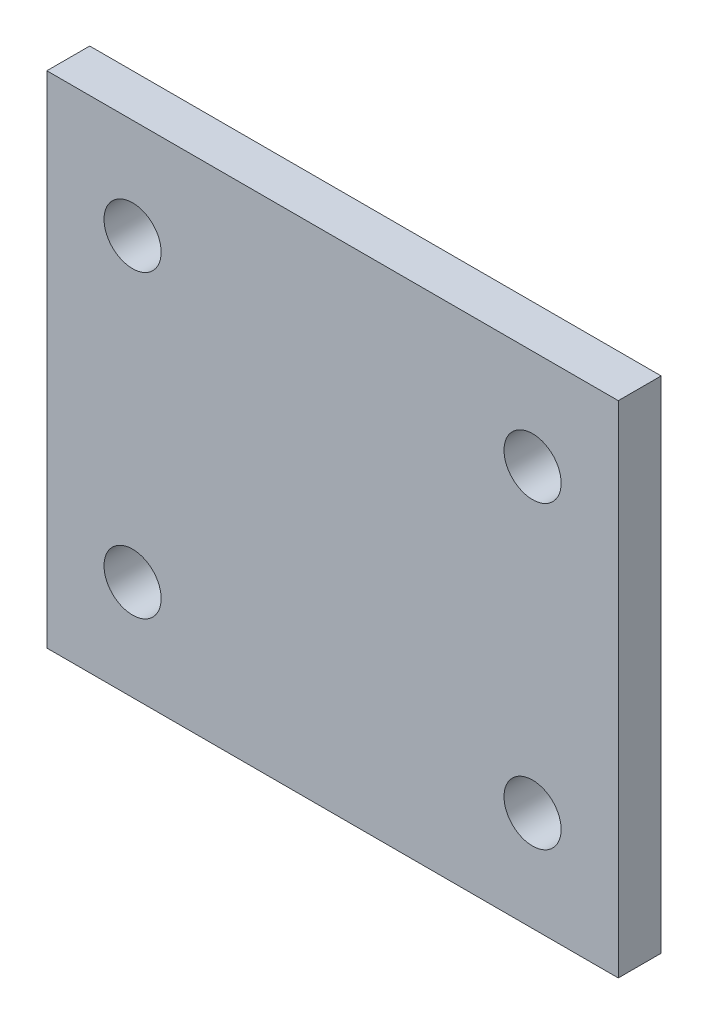
from build123d import *

# Parameters (mm, degrees)
SKETCH1_W           = 40
SKETCH1_H           = 35
BOSS_EXTRUDE1_DEPTH = 3
SKETCH2_R           = 2
CUT_EXTRUDE1_DEPTH  = 3


with BuildPart() as part:
    # Sketch1 → Boss-Extrude1 (new body)
    with BuildSketch(Plane.XY):
        with Locations((-2.389705882, 12.696078431)):
            Rectangle(SKETCH1_W, SKETCH1_H)
    extrude(amount=BOSS_EXTRUDE1_DEPTH)

    # Sketch2 → Cut-Extrude1 (cut)
    with BuildSketch(Plane.XY.offset(3)):
        with Locations((-16.389705882, 23.196078431)):
            Circle(SKETCH2_R)
        with Locations((-16.389705882, 2.196078431)):
            Circle(SKETCH2_R)
        with Locations((11.610294118, 2.196078431)):
            Circle(SKETCH2_R)
        with Locations((11.610294118, 23.196078431)):
            Circle(SKETCH2_R)
    extrude(amount=-CUT_EXTRUDE1_DEPTH, mode=Mode.SUBTRACT)


solid = part.part
